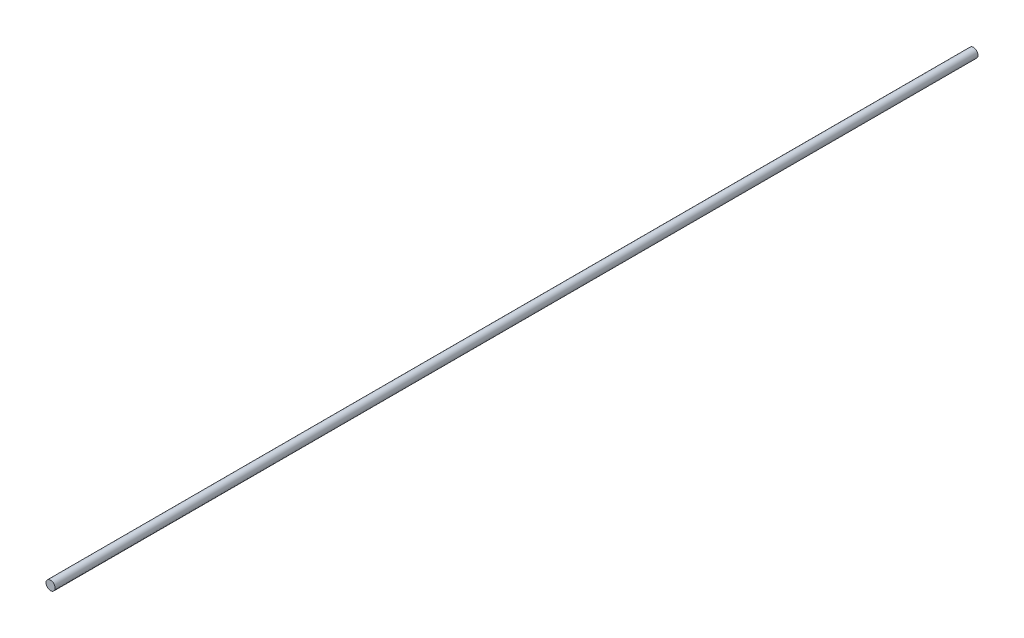
from build123d import *

# Parameters (mm, degrees)
SKETCH1_R           = 4
BOSS_EXTRUDE1_DEPTH = 810


with BuildPart() as part:
    # Sketch1 → Boss-Extrude1 (new body)
    with BuildSketch(Plane.XY):
        Circle(SKETCH1_R)
    extrude(amount=BOSS_EXTRUDE1_DEPTH)


solid = part.part
